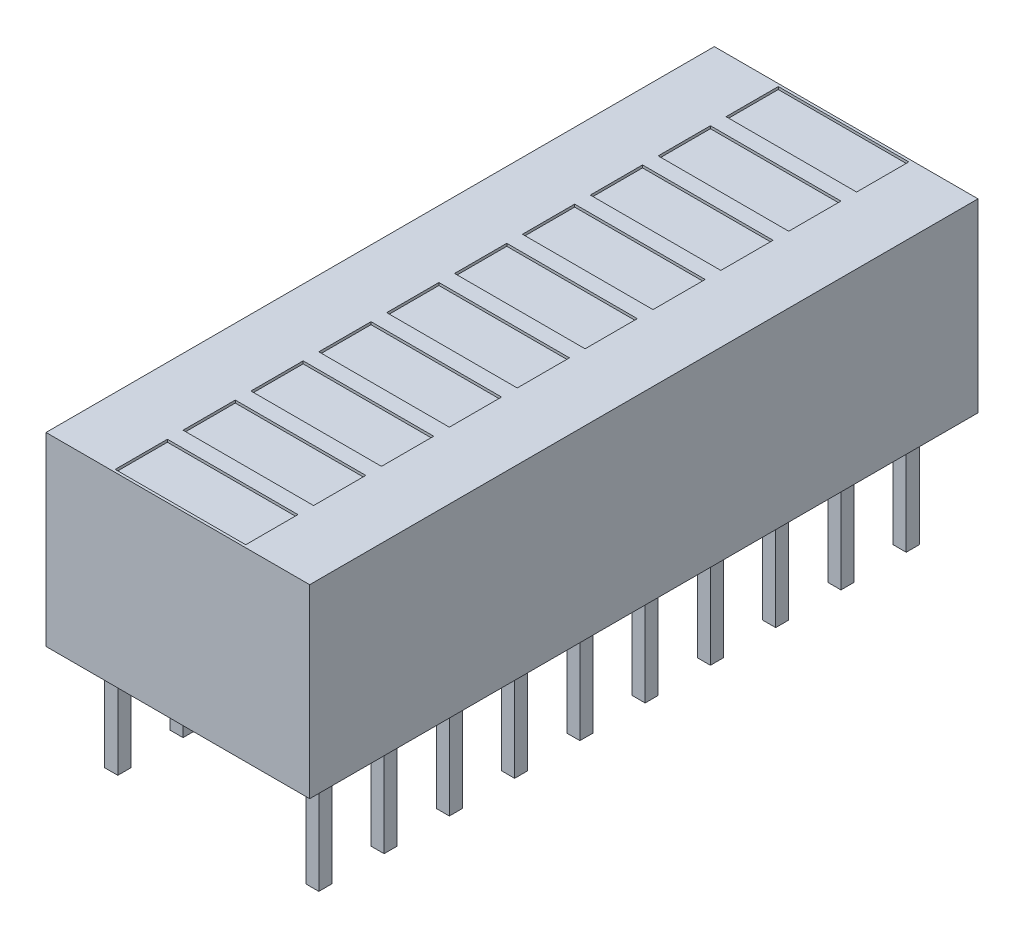
from build123d import *

# Parameters (mm, degrees)
SKETCH1_W           = 10.1
SKETCH1_H           = 25.6
BOSS_EXTRUDE1_DEPTH = 7.1
SKETCH2_W           = 0.5
SKETCH2_H           = 0.5
BOSS_EXTRUDE2_DEPTH = 4.2
SKETCH3_W           = 5
SKETCH3_H           = 2
CUT_EXTRUDE1_DEPTH  = 0.1


with BuildPart() as part:
    # Sketch1 → Boss-Extrude1 (new body)
    with BuildSketch(Plane(origin=(0, 0, 0), x_dir=(1, 0, 0), z_dir=(0, 1, 0))):
        Rectangle(SKETCH1_W, SKETCH1_H)
    extrude(amount=BOSS_EXTRUDE1_DEPTH)

    # Sketch2 → Boss-Extrude2 (add)
    with BuildSketch(Plane(origin=(0, 0, 0), x_dir=(1, 0, 0), z_dir=(0, 1, 0))):
        with Locations((3.85, -11.25)):
            Rectangle(SKETCH2_W, SKETCH2_H)
        with Locations((-3.85, -11.25)):
            Rectangle(SKETCH2_W, SKETCH2_H)
        with Locations((3.85, -8.75)):
            Rectangle(SKETCH2_W, SKETCH2_H)
        with Locations((3.85, -6.25)):
            Rectangle(SKETCH2_W, SKETCH2_H)
        with Locations((3.85, -3.75)):
            Rectangle(SKETCH2_W, SKETCH2_H)
        with Locations((3.85, -1.25)):
            Rectangle(SKETCH2_W, SKETCH2_H)
        with Locations((3.85, 1.25)):
            Rectangle(SKETCH2_W, SKETCH2_H)
        with Locations((3.85, 3.75)):
            Rectangle(SKETCH2_W, SKETCH2_H)
        with Locations((3.85, 6.25)):
            Rectangle(SKETCH2_W, SKETCH2_H)
        with Locations((3.85, 8.75)):
            Rectangle(SKETCH2_W, SKETCH2_H)
        with Locations((3.85, 11.25)):
            Rectangle(SKETCH2_W, SKETCH2_H)
        with Locations((-3.85, -8.75)):
            Rectangle(SKETCH2_W, SKETCH2_H)
        with Locations((-3.85, -6.25)):
            Rectangle(SKETCH2_W, SKETCH2_H)
        with Locations((-3.85, -3.75)):
            Rectangle(SKETCH2_W, SKETCH2_H)
        with Locations((-3.85, -1.25)):
            Rectangle(SKETCH2_W, SKETCH2_H)
        with Locations((-3.85, 1.25)):
            Rectangle(SKETCH2_W, SKETCH2_H)
        with Locations((-3.85, 3.75)):
            Rectangle(SKETCH2_W, SKETCH2_H)
        with Locations((-3.85, 6.25)):
            Rectangle(SKETCH2_W, SKETCH2_H)
        with Locations((-3.85, 8.75)):
            Rectangle(SKETCH2_W, SKETCH2_H)
        with Locations((-3.85, 11.25)):
            Rectangle(SKETCH2_W, SKETCH2_H)
    extrude(amount=-BOSS_EXTRUDE2_DEPTH)

    # Sketch3 → Cut-Extrude1 (cut)
    with BuildSketch(Plane(origin=(0, 7.1, 0), x_dir=(1, 0, 0), z_dir=(0, 1, 0))):
        with Locations((0, 9.1)):
            Rectangle(SKETCH3_W, SKETCH3_H)
        with Locations((0, 11.7)):
            Rectangle(SKETCH3_W, SKETCH3_H)
        with Locations((0, 6.5)):
            Rectangle(SKETCH3_W, SKETCH3_H)
        with Locations((0, 3.9)):
            Rectangle(SKETCH3_W, SKETCH3_H)
        with Locations((0, 1.3)):
            Rectangle(SKETCH3_W, SKETCH3_H)
        with Locations((0, -1.3)):
            Rectangle(SKETCH3_W, SKETCH3_H)
        with Locations((0, -3.9)):
            Rectangle(SKETCH3_W, SKETCH3_H)
        with Locations((0, -6.5)):
            Rectangle(SKETCH3_W, SKETCH3_H)
        with Locations((0, -9.1)):
            Rectangle(SKETCH3_W, SKETCH3_H)
        with Locations((0, -11.7)):
            Rectangle(SKETCH3_W, SKETCH3_H)
    extrude(amount=-CUT_EXTRUDE1_DEPTH, mode=Mode.SUBTRACT)


solid = part.part
